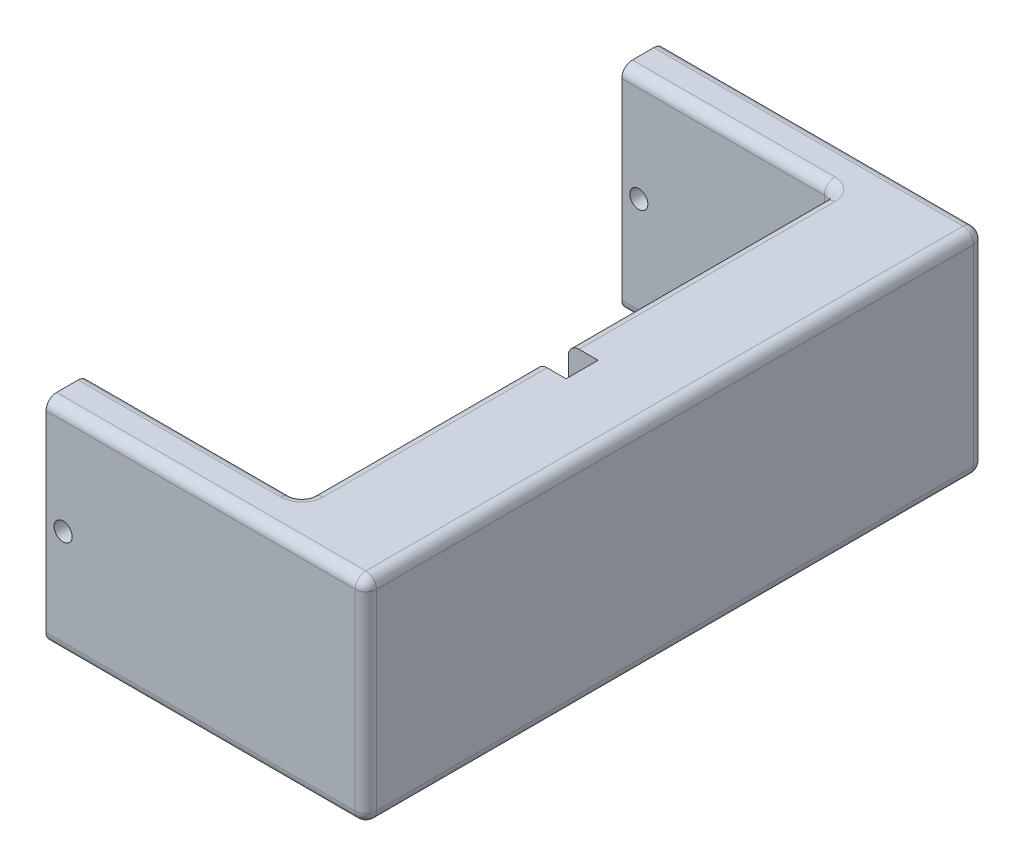
from build123d import *

# Parameters (mm, degrees)
SALIENTE_EXTRUIR1_DEPTH = 1
REDONDEO1_R             = 0.05
CROQUIS2_R              = 0.042335255
CORTAR_EXTRUIR1_DEPTH   = 4.414674216
CROQUIS3_W              = 0.230693599
CROQUIS3_H              = 0.15
CORTAR_EXTRUIR2_DEPTH   = 0.2


with BuildPart() as part:
    # Croquis1 → Saliente-Extruir1 (new body)
    with BuildSketch(Plane(origin=(0, 0, 0), x_dir=(1, 0, 0), z_dir=(0, 1, 0))):
        Polygon((0, -1.45), (1.5, -1.45), (1.5, 1.45), (0, 1.45), (0, 1.25), (1, 1.25), (1, -1.25), (0, -1.25), align=None)
    extrude(amount=SALIENTE_EXTRUIR1_DEPTH)

    # Redondeo1
    redondeo1_edges = [part.edges().sort_by_distance(p)[0] for p in [
        (0.75, 0, -1.45),
        (1.5, 0, 0),
        (0.75, 0, 1.45),
        (1.5, 1, 0),
        (1, 0.5, 1.25),
        (1, 0.5, -1.25),
        (1.5, 0.5, -1.45),
        (1.5, 0.5, 1.45),
        (0.75, 1, -1.45),
        (0.5, 1, -1.25),
        (1, 1, 0),
        (0.5, 1, 1.25),
        (0.5, 0, 1.25),
        (0.75, 1, 1.45),
        (1, 0, 0),
        (0.5, 0, -1.25),
    ]]
    fillet(redondeo1_edges, radius=REDONDEO1_R)

    # Croquis2 → Cortar-Extruir1 (cut, through all)
    with BuildSketch(Plane.XY.offset(1.45)):
        with Locations((0.08, 0.5)):
            Circle(CROQUIS2_R)
    extrude(amount=-CORTAR_EXTRUIR1_DEPTH, mode=Mode.SUBTRACT)

    # Croquis3 → Cortar-Extruir2 (cut)
    with BuildSketch(Plane(origin=(0, 1, 0), x_dir=(1, 0, 0), z_dir=(0, 1, 0))):
        with Locations((1.023868656, -0.075284887)):
            Rectangle(CROQUIS3_W, CROQUIS3_H)
    extrude(amount=-CORTAR_EXTRUIR2_DEPTH, mode=Mode.SUBTRACT)


solid = part.part
